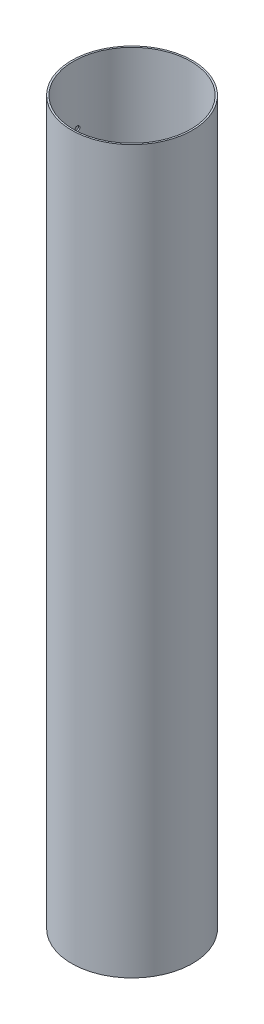
from build123d import *

# Parameters (mm, degrees)
SKETCH1_R           = 51.054
SKETCH1_R_2         = 49.657
BOSS_EXTRUDE1_DEPTH = 609.6
SKETCH2_R           = 1.984375
CUT_EXTRUDE1_DEPTH  = 12.7
CIRPATTERN1_COUNT   = 4


with BuildPart() as part:
    # Sketch1 → Boss-Extrude1 (new body)
    with BuildSketch(Plane(origin=(0, 0, 0), x_dir=(1, 0, 0), z_dir=(0, 1, 0))):
        with Locations(Location((0, 0, 0), (0, 0, 90))):
            Circle(SKETCH1_R)
        with Locations(Location((0, 0, 0), (0, 0, 90))):
            Circle(SKETCH1_R_2, mode=Mode.SUBTRACT)
    extrude(amount=BOSS_EXTRUDE1_DEPTH)

    # Sketch2 → Cut-Extrude1 (cut)
    with BuildSketch(Plane(origin=(122.899951256, 815.595371644, -42.551362721), x_dir=(-0.9976910351931784, 0, -0.067916112191174), z_dir=(0.067916112191174, 0, -0.9976910351931785))):
        with Locations((119.72625647, -256.795371644)):
            Circle(SKETCH2_R)
    cut_extrude1 = extrude(amount=-CUT_EXTRUDE1_DEPTH, mode=Mode.SUBTRACT)

    # CirPattern1: Cut-Extrude1 ×4 about axis
    cirpattern1_axis = Axis((0, 0, 0), (0, 1, 0))
    for i in range(1, CIRPATTERN1_COUNT):
        add(cut_extrude1.rotate(cirpattern1_axis, i * 360 / CIRPATTERN1_COUNT), mode=Mode.SUBTRACT)


solid = part.part
